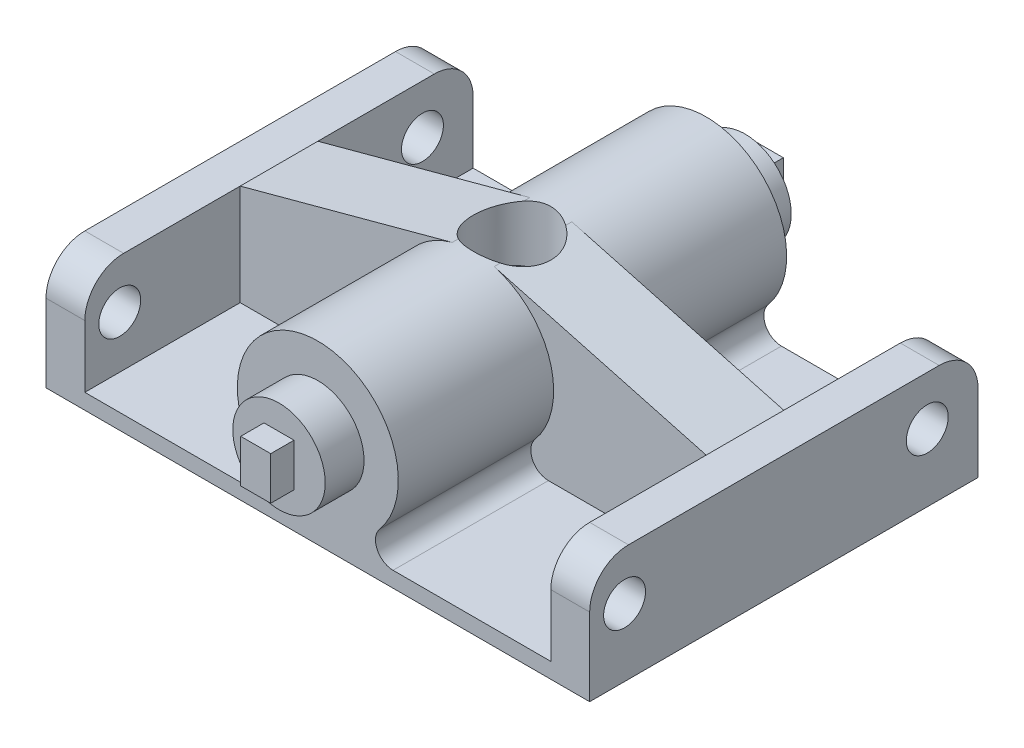
from build123d import *
from build123d.topology import SkipClean

# Parameters (mm, degrees)
BOSS_EXTRUDE1_DEPTH      = 5
BOSS_EXTRUDE2_DEPTH      = 20
MIRROR3_COPY_1_DEPTH     = 5
MIRROR3_COPY_2_DEPTH     = 20
SKETCH4_R                = 2.698355907
CUT_EXTRUDE1_DEPTH       = 5
BOSS_EXTRUDE3_DEPTH      = 5
BOSS_EXTRUDE3_DEPTH_BACK = 55
SKETCH8_R                = 5.951026126
SKETCH8_W                = 3.866122338
SKETCH8_H                = 5.532358837
BOSS_EXTRUDE5_DEPTH      = 3
BOSS_EXTRUDE5_DEPTH_BACK = 63
SKETCH10_W               = 3.866122338
SKETCH10_H               = 5.532358837
SKETCH12_R               = 5
CUT_EXTRUDE3_DEPTH       = 7.59683428
SKETCH14_W               = 4.609426796
SKETCH14_H               = 4.865506062
CUT_EXTRUDE6_DEPTH       = 4


with BuildPart() as part:
    # Sketch1 → Boss-Extrude1 (new body)
    with BuildSketch(Plane.XY):
        with BuildLine():
            Line((30, 2), (30, 15))
            Line((30, 15), (2.700298335, 22.368034529))
            ThreePointArc((2.700298335, 22.368034529), (9.883500212, 15.478856519), (7.950094011, 5.715603818))
            ThreePointArc((7.950094011, 5.715603818), (7.635951646, 3.305180914), (9.686640989, 2))
            Line((9.686640989, 2), (30, 2))
        make_face()
        with BuildLine():
            ThreePointArc((7.950094011, 5.715603818), (7.635951646, 3.305180914), (9.686640989, 2))
            Line((9.686640989, 2), (30, 2))
            Line((30, 2), (30, 15))
            Line((30, 15), (35, 15))
            Line((35, 15), (35, 0))
            Line((35, 0), (0, 0))
            Line((0, 0), (0, 2))
            Line((0, 2), (0, 6.411987573))
            ThreePointArc((0, 6.411987573), (5.951026126, 12.363013699), (0, 18.314039825))
            Line((0, 18.314039825), (0, 22.726027397))
            ThreePointArc((0, 22.726027397), (9.388270676, 16.750772424), (7.950094011, 5.715603818))
        make_face()
    boss_extrude1 = extrude(amount=BOSS_EXTRUDE1_DEPTH)

    # Sketch3 → Boss-Extrude2 (add)
    with BuildSketch(Plane.XY.offset(5)):
        with BuildLine():
            ThreePointArc((7.950094011, 5.715603818), (9.883500212, 15.478856519), (2.700298335, 22.368034529))
            ThreePointArc((2.700298335, 22.368034529), (1.361962737, 22.636139339), (0, 22.726027397))
            Line((0, 22.726027397), (0, 18.314039825))
            ThreePointArc((0, 18.314039825), (5.951026126, 12.363013699), (0, 6.411987573))
            Line((0, 6.411987573), (0, 2))
            Line((0, 2), (0, 0))
            Line((0, 0), (35, 0))
            Line((35, 0), (35, 15))
            Line((35, 15), (30, 15))
            Line((30, 15), (30, 2))
            Line((30, 2), (9.686640989, 2))
            ThreePointArc((9.686640989, 2), (7.635951646, 3.305180914), (7.950094011, 5.715603818))
        make_face()
    boss_extrude2 = extrude(amount=BOSS_EXTRUDE2_DEPTH)

    # Mirror2: Boss-Extrude1, Boss-Extrude2 across plane
    add(boss_extrude1.mirror(Plane.ZY))
    add(boss_extrude2.mirror(Plane.ZY))

    # Mirror3: Boss-Extrude1, Boss-Extrude2 across Front Plane
    with SkipClean():  # the faces are left unmerged after this step: merging them gives an invalid solid
        add(boss_extrude1.mirror(Plane.XY))
        add(boss_extrude2.mirror(Plane.XY))

    # Mirror3 copy 1 sketch → Mirror3 copy 1 (add)
    with BuildSketch(Plane(origin=(0, 0, 0), x_dir=(-1, 0, 0), z_dir=(0, 0, -1))):
        with BuildLine():
            Line((30, 2), (30, 15))
            Line((30, 15), (2.700298335, 22.368034529))
            ThreePointArc((2.700298335, 22.368034529), (9.883500212, 15.478856519), (7.950094011, 5.715603818))
            ThreePointArc((7.950094011, 5.715603818), (7.635951646, 3.305180914), (9.686640989, 2))
            Line((9.686640989, 2), (30, 2))
        make_face()
        with BuildLine():
            ThreePointArc((7.950094011, 5.715603818), (7.635951646, 3.305180914), (9.686640989, 2))
            Line((9.686640989, 2), (30, 2))
            Line((30, 2), (30, 15))
            Line((30, 15), (35, 15))
            Line((35, 15), (35, 0))
            Line((35, 0), (0, 0))
            Line((0, 0), (0, 2))
            Line((0, 2), (0, 6.411987573))
            ThreePointArc((0, 6.411987573), (5.951026126, 12.363013699), (0, 18.314039825))
            Line((0, 18.314039825), (0, 22.726027397))
            ThreePointArc((0, 22.726027397), (9.388270676, 16.750772424), (7.950094011, 5.715603818))
        make_face()
    extrude(amount=MIRROR3_COPY_1_DEPTH)

    # Mirror3 copy 2 sketch → Mirror3 copy 2 (add)
    with SkipClean():  # the faces are left unmerged after this step: merging them gives an invalid solid
        with BuildSketch(Plane(origin=(0, 0, -5), x_dir=(-1, 0, 0), z_dir=(0, 0, -1))):
            with BuildLine():
                ThreePointArc((7.950094011, 5.715603818), (9.883500212, 15.478856519), (2.700298335, 22.368034529))
                ThreePointArc((2.700298335, 22.368034529), (1.361962737, 22.636139339), (0, 22.726027397))
                Line((0, 22.726027397), (0, 18.314039825))
                ThreePointArc((0, 18.314039825), (5.951026126, 12.363013699), (0, 6.411987573))
                Line((0, 6.411987573), (0, 2))
                Line((0, 2), (0, 0))
                Line((0, 0), (35, 0))
                Line((35, 0), (35, 15))
                Line((35, 15), (30, 15))
                Line((30, 15), (30, 2))
                Line((30, 2), (9.686640989, 2))
                ThreePointArc((9.686640989, 2), (7.635951646, 3.305180914), (7.950094011, 5.715603818))
            make_face()
        extrude(amount=MIRROR3_COPY_2_DEPTH)

    # Sketch4 → Cut-Extrude1 (cut)
    with SkipClean():  # the faces are left unmerged after this step: merging them gives an invalid solid
        with BuildSketch(Plane(origin=(35, 0, 0), x_dir=(0, 0, -1), z_dir=(1, 0, 0))):
            with Locations((-20.507504892, 8.694639524)):
                Circle(SKETCH4_R)
            with Locations((18.468747096, 8.694639524)):
                Circle(SKETCH4_R)
            with BuildLine():
                Line((-25, 10), (-27.403303321, 11.153141573))
                Line((-27.403303321, 11.153141573), (-26.20165166, 17.389341891))
                Line((-26.20165166, 17.389341891), (-20, 16.194347401))
                Line((-20, 16.194347401), (-20, 15))
                ThreePointArc((-20, 15), (-23.535533906, 13.535533906), (-25, 10))
            make_face()
            with BuildLine():
                Line((20, 15), (20.74735875, 17.389341891))
                Line((20.74735875, 17.389341891), (31.360891984, 16.194670945))
                Line((31.360891984, 16.194670945), (27.103485998, 9.174347241))
                Line((27.103485998, 9.174347241), (25, 10))
                ThreePointArc((25, 10), (23.535533906, 13.535533906), (20, 15))
            make_face()
        cut_extrude1 = extrude(amount=-CUT_EXTRUDE1_DEPTH, mode=Mode.SUBTRACT)

    # Mirror4: Cut-Extrude1 across plane
    with SkipClean():  # the faces are left unmerged after this step: merging them gives an invalid solid
        add(cut_extrude1.mirror(Plane.ZY), mode=Mode.SUBTRACT)

    # Sketch8 → Boss-Extrude3 (add, two sides: drawn at the far end of the back side and taken through both)
    with SkipClean():  # the faces are left unmerged after this step: merging them gives an invalid solid
        with BuildSketch(Plane.XY.offset(25).offset(-BOSS_EXTRUDE3_DEPTH_BACK)):
            with Locations((0, 12.363013699)):
                Circle(SKETCH8_R)
            with Locations((0, 12.363013699)):
                Rectangle(SKETCH8_W, SKETCH8_H, mode=Mode.SUBTRACT)
        extrude(amount=BOSS_EXTRUDE3_DEPTH + BOSS_EXTRUDE3_DEPTH_BACK)

    # Sketch10 → Boss-Extrude5 (add, two sides: drawn at the far end of the back side and taken through both)
    with SkipClean():  # the faces are left unmerged after this step: merging them gives an invalid solid
        with BuildSketch(Plane.XY.offset(30).offset(-BOSS_EXTRUDE5_DEPTH_BACK)):
            with Locations((0, 12.363013699)):
                Rectangle(SKETCH10_W, SKETCH10_H)
        extrude(amount=BOSS_EXTRUDE5_DEPTH + BOSS_EXTRUDE5_DEPTH_BACK)

    # Sketch12 → Cut-Extrude3 (cut)
    with SkipClean():  # the faces are left unmerged after this step: merging them gives an invalid solid
        with BuildSketch(Plane.XZ.offset(-22.726027397)):
            with Locations(Location((0, 0, 0), (0, 0, 57.312299274))):
                Circle(SKETCH12_R)
        extrude(amount=CUT_EXTRUDE3_DEPTH, mode=Mode.SUBTRACT)

    # Sketch14 → Cut-Extrude6 (cut, symmetric)
    with SkipClean():  # the faces are left unmerged after this step: merging them gives an invalid solid
        with BuildSketch(Plane(origin=(0, 15.129193117, 0), x_dir=(1, 0, 0), z_dir=(0, 1, 0))):
            Rectangle(SKETCH14_W, SKETCH14_H)
        extrude(amount=CUT_EXTRUDE6_DEPTH, both=True, mode=Mode.SUBTRACT)


solid = part.part
